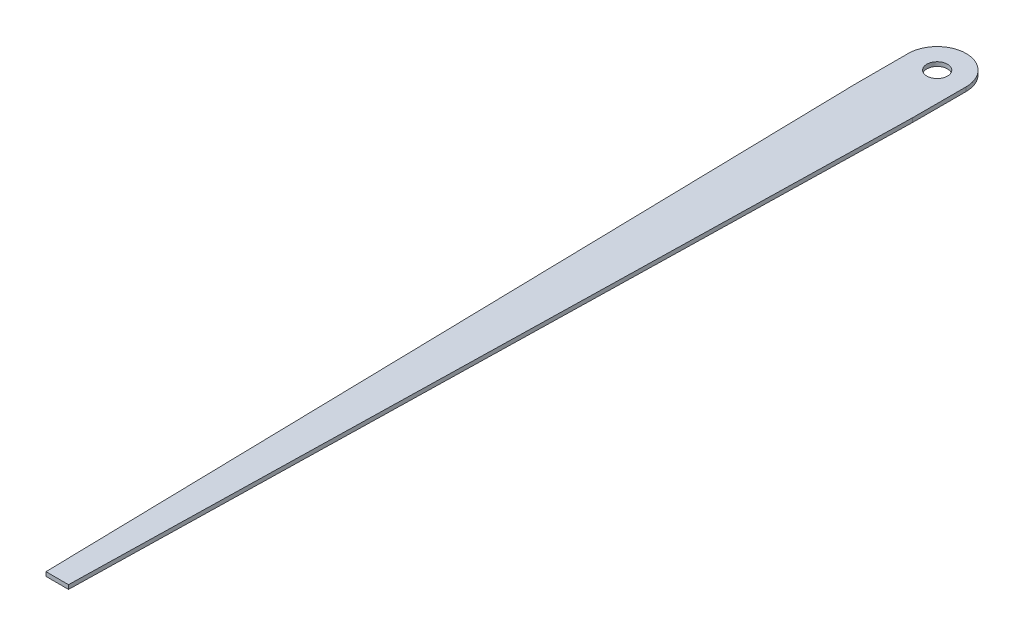
from build123d import *

# Parameters (mm, degrees)
BOSS_EXTRUDE1_DEPTH = 1
SKETCH2_R           = 2.5
BOSS_EXTRUDE2_DEPTH = 1


with BuildPart() as part:
    # Sketch1 → Boss-Extrude1 (new body)
    with BuildSketch(Plane(origin=(0, 0, 0), x_dir=(1, 0, 0), z_dir=(0, 1, 0))):
        Polygon((9.725, 200), (4.275, 200), (0, 200), (4.275, 0), (9.725, 0), (14, 200), align=None)
    extrude(amount=BOSS_EXTRUDE1_DEPTH)

    # Sketch2 → Boss-Extrude2 (add)
    with BuildSketch(Plane.XZ):
        with BuildLine():
            Line((0, -200), (14, -200))
            Line((14, -200), (14, -213))
            ThreePointArc((14, -213), (7, -220), (0, -213))
            Line((0, -213), (0, -200))
        make_face()
        with Locations(Location((7, -213, 0), (0, 0, 270))):
            Circle(SKETCH2_R, mode=Mode.SUBTRACT)
    extrude(amount=-BOSS_EXTRUDE2_DEPTH)


solid = part.part
